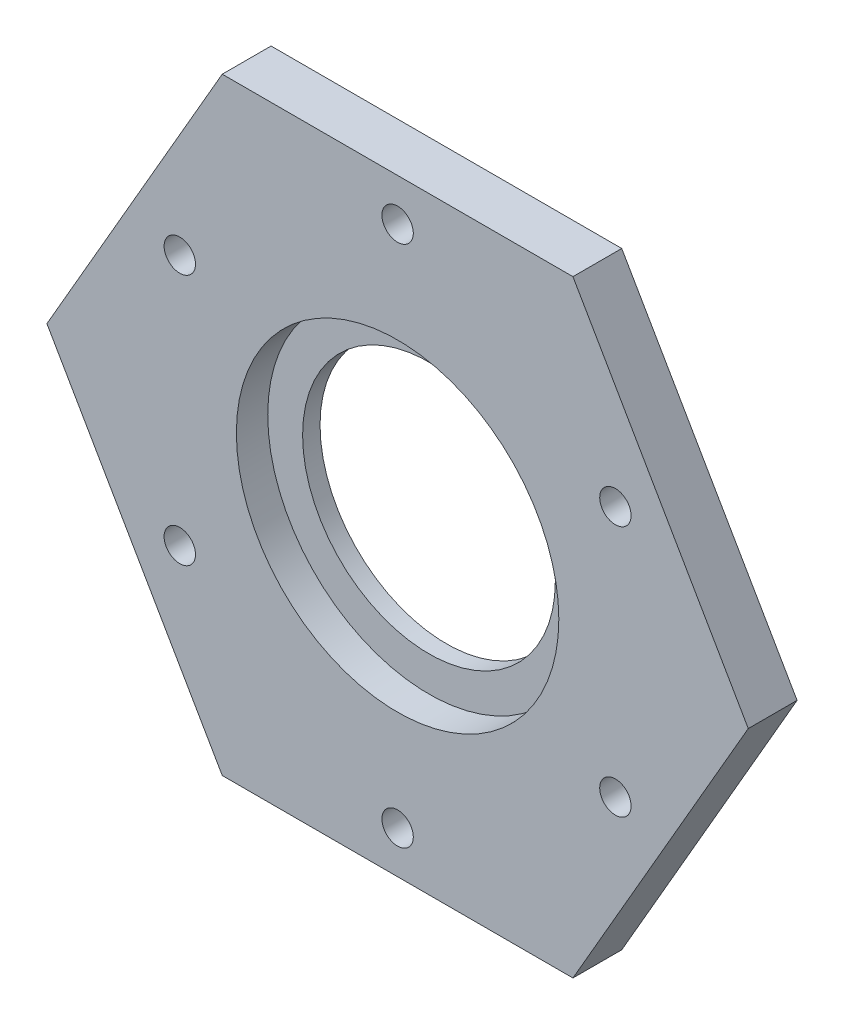
from build123d import *

# Parameters (mm, degrees)
EXTRUDE_1_DEPTH      = 7
CUT_EXTRUDE_1_DEPTH  = 1.8
CUT_EXTRUDE_2_DEPTH  = 3
EXTRUDE_4_DEPTH      = 5.7
EXTRUDE_4_2_DEPTH    = 5.7
EXTRUDE_4_3_DEPTH    = 5.7
EXTRUDE_4_4_DEPTH    = 5.7
EXTRUDE_21_DEPTH     = 3.5
EXTRUDE_21_2_DEPTH   = 3.5
EXTRUDE_21_3_DEPTH   = 3.5
EXTRUDE_21_4_DEPTH   = 3.5
EXTRUDE_22_DEPTH     = 1
CUT_EXTRUDE_3_DEPTH  = 10
CUT_EXTRUDE_4_DEPTH  = 1.5
CUT_EXTRUDE_5_DEPTH  = 1
EXTRUDE_23_DEPTH     = 1.6
SKETCH_17_R          = 0.9
CUT_EXTRUDE_6_DEPTH  = 20
SKETCH_19_R          = 1.75
CUT_EXTRUDE_7_DEPTH  = 2
SKETCH_20_R          = 0.9
CUT_EXTRUDE_8_DEPTH  = 6
EXTRUDE_START        = 2.8
SKETCH_22_R          = 0.9
SKETCH_22_R_2        = 9.25
EXTRUDE_24_DEPTH     = 2.8
SKETCH_24_R          = 9.25
SKETCH_24_R_2        = 7.25
EXTRUDE_25_DEPTH     = 1
SKETCH_25_W          = 43.271682287
SKETCH_25_H          = 17.110923283
CUT_EXTRUDE_9_DEPTH  = 47
SKETCH_26_W          = 20.812214232
SKETCH_26_H          = 53.146859293
CUT_EXTRUDE_10_DEPTH = 99


with BuildPart() as part:
    # 草图1 → 凸台-拉伸1 (new body)
    with BuildSketch(Plane.XY):
        Polygon((10.059401077, 17.423393759), (-10.059401077, 17.423393759), (-20.118802154, 0), (-10.059401077, -17.423393759), (10.059401077, -17.423393759), (20.118802154, 0), align=None)
        Polygon((15.5, 0), (7.75, 13.423393759), (-7.75, 13.423393759), (-15.5, 0), (-7.75, -13.423393759), (7.75, -13.423393759), align=None, mode=Mode.SUBTRACT)
    extrude(amount=EXTRUDE_1_DEPTH)

    # 草图2 → 切除-拉伸1 (cut)
    with BuildSketch(Plane.XY.offset(7)):
        Polygon((6.863269886, -16.440794429), (6.863269886, -13.423393759), (-6.863269886, -13.423393759), (-6.863269886, -16.440794429), (-5.880670556, -17.423393759), (5.880670556, -17.423393759), align=None)
        Polygon((-4.820110193, 16.061828693), (4.820110193, 16.061828693), (5.573466666, 15.349903558), (5.573466666, 13.423393759), (-5.573466666, 13.423393759), (-5.573466666, 15.349903558), align=None)
    extrude(amount=-CUT_EXTRUDE_1_DEPTH, mode=Mode.SUBTRACT)

    # 草图3 → 切除-拉伸2 (cut)
    with BuildSketch(Plane.XY.offset(7)):
        Polygon((8.460606166, 12.192587775), (11.924707781, 14.192587775), (18.428840745, 2.927099023), (14.96473913, 0.927099023), align=None)
    extrude(amount=-CUT_EXTRUDE_2_DEPTH, mode=Mode.SUBTRACT)

    # 草图15 → 切除-拉伸5 (cut)
    with BuildSketch(Plane.XY.offset(5.2)):
        Polygon((-2.444629032, 16.061828693), (-2.444629032, 13.423393759), (-5.573466666, 13.423393759), (-5.573466666, 15.349903558), (-4.820110193, 16.061828693), align=None)
        Polygon((4.820110193, 16.061828693), (2.444629032, 16.061828693), (2.444629032, 13.423393759), (5.573466666, 13.423393759), (5.573466666, 15.349903558), align=None)
    extrude(amount=-CUT_EXTRUDE_5_DEPTH, mode=Mode.SUBTRACT)

    # 草图18 → 凸台-拉伸23 (add)
    with BuildSketch(Plane.XY.offset(7)):
        Polygon((-4.820110193, 16.061828693), (-4.820110193, 17.423393759), (-10.059401077, 17.423393759), (-20.118802154, 0), (-10.059401077, -17.423393759), (-5.880670556, -17.423393759), (-6.863269886, -16.440794429), (-6.863269886, -13.423393759), (-7.75, -13.423393759), (-15.5, 0), (-7.75, 13.423393759), (-5.573466666, 13.423393759), (-5.573466666, 15.349903558), align=None)
        Polygon((4.820110193, 16.061828693), (4.820110193, 17.423393759), (10.059401077, 17.423393759), (11.924707781, 14.192587775), (8.460606166, 12.192587775), (7.75, 13.423393759), (5.573466666, 13.423393759), (5.573466666, 15.349903558), align=None)
        Polygon((18.428840745, 2.927099023), (14.96473913, 0.927099023), (15.5, 0), (7.75, -13.423393759), (6.863269886, -13.423393759), (6.863269886, -16.440794429), (5.880670556, -17.423393759), (10.059401077, -17.423393759), (20.118802154, 0), align=None)
    extrude(amount=EXTRUDE_23_DEPTH)


with BuildPart() as body_2:
    # 草图4 → 凸台-拉伸4 (new body)
    with BuildSketch(Plane(origin=(0, 0, 0), x_dir=(-1, 0, 0), z_dir=(0, 0, -1))):
        Polygon((-11.245593136, -7.368848845), (-6.382277748, -7.368848845), (-6.382277748, -13.423393759), (-7.75, -13.423393759), align=None)
    extrude(amount=-EXTRUDE_4_DEPTH)


with BuildPart() as body_3:
    # 草图4 → Extrude 4 2 (new body)
    with BuildSketch(Plane(origin=(0, 0, 0), x_dir=(-1, 0, 0), z_dir=(0, 0, -1))):
        Polygon((6.145280676, -7.368848845), (11.245593136, -7.368848845), (7.75, -13.423393759), (6.145280676, -13.423393759), align=None)
    extrude(amount=-EXTRUDE_4_2_DEPTH)


with BuildPart() as body_4:
    # 草图4 → Extrude 4 3 (new body)
    with BuildSketch(Plane(origin=(0, 0, 0), x_dir=(-1, 0, 0), z_dir=(0, 0, -1))):
        Polygon((6.145280676, 13.423393759), (6.145280676, 8.488540604), (10.599138797, 8.488540604), (7.75, 13.423393759), align=None)
    extrude(amount=-EXTRUDE_4_3_DEPTH)


with BuildPart() as body_5:
    # 草图4 → Extrude 4 4 (new body)
    with BuildSketch(Plane(origin=(0, 0, 0), x_dir=(-1, 0, 0), z_dir=(0, 0, -1))):
        Polygon((-8.460606166, 12.192587775), (-6.674189613, 11.161199697), (-13.502811472, -0.666320308), (-15.289228025, 0.365067769), align=None)
    extrude(amount=-EXTRUDE_4_4_DEPTH)


with BuildPart() as body_6:
    # 草图6 → 凸台-拉伸21 (new body)
    with BuildSketch(Plane(origin=(0, 0, 0), x_dir=(-1, 0, 0), z_dir=(0, 0, -1))):
        Polygon((-7.167145457, 10.307375129), (-6.189945384, 10.307375129), (-6.189945384, -5.980150499), (-12.0473585, -5.980150499), (-13.626264811, -5.980150499), (-17.36358489, 0), (-11.472554935, 10.307375129), (-9.549034195, 10.307375129), align=None)
    extrude(amount=-EXTRUDE_21_DEPTH)


with BuildPart() as body_7:
    # 草图6 → Extrude 21 2 (new body)
    with BuildSketch(Plane(origin=(0, 0, 0), x_dir=(-1, 0, 0), z_dir=(0, 0, -1))):
        Polygon((-5.839026937, 13.423393759), (-5.839026937, 11.342651293), (5.746496449, 11.342651293), (5.746496449, 13.423393759), (5.746496449, 15.340981073), (-5.839026937, 15.340981073), align=None)
    extrude(amount=-EXTRUDE_21_2_DEPTH)


with BuildPart() as body_8:
    # 草图6 → Extrude 21 3 (new body)
    with BuildSketch(Plane(origin=(0, 0, 0), x_dir=(-1, 0, 0), z_dir=(0, 0, -1))):
        Polygon((6.145280676, 7.264816527), (6.145280676, 3.935780446), (14.892625012, 3.935780446), (12.812129983, 7.264816527), align=None)
    extrude(amount=-EXTRUDE_21_3_DEPTH)


with BuildPart() as body_9:
    # 草图6 → Extrude 21 4 (new body)
    with BuildSketch(Plane(origin=(0, 0, 0), x_dir=(-1, 0, 0), z_dir=(0, 0, -1))):
        Polygon((6.145280676, -5.980150499), (12.0473585, -5.980150499), (13.934439655, -5.980150499), (17.352307472, 0), (6.145280676, 0), align=None)
    extrude(amount=-EXTRUDE_21_4_DEPTH)


with BuildPart() as body_10:
    # 草图12 → 凸台-拉伸22 (new body)
    with BuildSketch(Plane(origin=(0, 0, 0), x_dir=(-1, 0, 0), z_dir=(0, 0, -1))):
        Polygon((-10.059401077, 17.423393759), (-20.118802154, 0), (-10.059401077, -17.423393759), (10.059401077, -17.423393759), (20.118802154, 0), (10.059401077, 17.423393759), align=None)
    extrude(amount=EXTRUDE_22_DEPTH)

    # 草图13 → 切除-拉伸3 (cut)
    with BuildSketch(Plane(origin=(0, 0, -1), x_dir=(-1, 0, 0), z_dir=(0, 0, -1))):
        with BuildLine():
            Line((10.123406841, 1.062471913), (7.135900995, 1.062471913))
            ThreePointArc((7.135900995, 1.062471913), (5.95884516, 2.239527747), (7.135900995, 3.416583581))
            Line((7.135900995, 3.416583581), (10.123406841, 3.416583581))
            ThreePointArc((10.123406841, 3.416583581), (11.300462675, 2.239527747), (10.123406841, 1.062471913))
        make_face()
    extrude(amount=-CUT_EXTRUDE_3_DEPTH, mode=Mode.SUBTRACT)


with BuildPart() as cut_extrude_4_tool:
    # 草图14 → 切除-拉伸4 (new body)
    with BuildSketch(Plane.XY.offset(5.7)):
        Polygon((-7.75, 13.423393759), (-6.145280676, 13.423393759), (-6.145280676, 8.463494867), (-10.599138797, 8.488540604), align=None)
        Polygon((8.460347777, 12.192438594), (8.460347777, 8.067483007), (6.674189613, 11.161199697), align=None)
    extrude(amount=-CUT_EXTRUDE_4_DEPTH)


with BuildPart() as body_4_1:
    add(body_4.part)

    # 切除-拉伸4: cut by cut_extrude_4_tool
    add(cut_extrude_4_tool.part, mode=Mode.SUBTRACT)


with BuildPart() as body_5_1:
    add(body_5.part)

    # 切除-拉伸4: cut by cut_extrude_4_tool
    add(cut_extrude_4_tool.part, mode=Mode.SUBTRACT)


with BuildPart() as cut_extrude_6_tool:
    # 草图17 → 切除-拉伸6 (new body)
    with BuildSketch(Plane(origin=(0, 0, -1), x_dir=(-1, 0, 0), z_dir=(0, 0, -1))):
        with Locations((8, 15)):
            Circle(SKETCH_17_R)
        with Locations((8, -15)):
            Circle(SKETCH_17_R)
        with Locations((-8, -15)):
            Circle(SKETCH_17_R)
        with Locations((-8, 15)):
            Circle(SKETCH_17_R)
        with Locations((17.5, 0)):
            Circle(SKETCH_17_R)
        with Locations((-17.5, 0)):
            Circle(SKETCH_17_R)
    extrude(amount=-CUT_EXTRUDE_6_DEPTH)


with BuildPart() as part_1:
    add(part.part)

    # 切除-拉伸6: cut by cut_extrude_6_tool
    add(cut_extrude_6_tool.part, mode=Mode.SUBTRACT)


with BuildPart() as body_6_1:
    add(body_6.part)

    # 切除-拉伸6: cut by cut_extrude_6_tool
    add(cut_extrude_6_tool.part, mode=Mode.SUBTRACT)


with BuildPart() as body_9_1:
    add(body_9.part)

    # 切除-拉伸6: cut by cut_extrude_6_tool
    add(cut_extrude_6_tool.part, mode=Mode.SUBTRACT)


with BuildPart() as body_10_1:
    add(body_10.part)

    # 切除-拉伸6: cut by cut_extrude_6_tool
    add(cut_extrude_6_tool.part, mode=Mode.SUBTRACT)


with BuildPart() as cut_extrude_7_tool:
    # 草图19 → 切除-拉伸7 (new body)
    with BuildSketch(Plane(origin=(0, 0, -1), x_dir=(-1, 0, 0), z_dir=(0, 0, -1))):
        with Locations((-8, 15)):
            Circle(SKETCH_19_R)
        with Locations((-17.5, 0)):
            Circle(SKETCH_19_R)
        with Locations((-8, -15)):
            Circle(SKETCH_19_R)
        with Locations((8, -15)):
            Circle(SKETCH_19_R)
        with Locations((17.5, 0)):
            Circle(SKETCH_19_R)
        with Locations((8, 15)):
            Circle(SKETCH_19_R)
    extrude(amount=-CUT_EXTRUDE_7_DEPTH)


with BuildPart() as part_2:
    add(part_1.part)

    # 切除-拉伸7: cut by cut_extrude_7_tool
    add(cut_extrude_7_tool.part, mode=Mode.SUBTRACT)


with BuildPart() as body_2_1:
    add(body_2.part)

    # 切除-拉伸7: cut by cut_extrude_7_tool
    add(cut_extrude_7_tool.part, mode=Mode.SUBTRACT)


with BuildPart() as body_3_1:
    add(body_3.part)

    # 切除-拉伸7: cut by cut_extrude_7_tool
    add(cut_extrude_7_tool.part, mode=Mode.SUBTRACT)


with BuildPart() as body_4_2:
    add(body_4_1.part)

    # 切除-拉伸7: cut by cut_extrude_7_tool
    add(cut_extrude_7_tool.part, mode=Mode.SUBTRACT)


with BuildPart() as body_6_2:
    add(body_6_1.part)

    # 切除-拉伸7: cut by cut_extrude_7_tool
    add(cut_extrude_7_tool.part, mode=Mode.SUBTRACT)


with BuildPart() as body_9_2:
    add(body_9_1.part)

    # 切除-拉伸7: cut by cut_extrude_7_tool
    add(cut_extrude_7_tool.part, mode=Mode.SUBTRACT)


with BuildPart() as body_10_2:
    add(body_10_1.part)

    # 切除-拉伸7: cut by cut_extrude_7_tool
    add(cut_extrude_7_tool.part, mode=Mode.SUBTRACT)


with BuildPart() as cut_extrude_8_tool:
    # 草图20 → 切除-拉伸8 (new body)
    with BuildSketch(Plane(origin=(0, 0, -1), x_dir=(-1, 0, 0), z_dir=(0, 0, -1))):
        with Locations((0, 15)):
            Circle(SKETCH_20_R)
        with Locations((-12.495190528, 7.214101615)):
            Circle(SKETCH_20_R)
        with Locations((12.495190528, 7.214101615)):
            Circle(SKETCH_20_R)
        with Locations((-12.495190528, -7.214101615)):
            Circle(SKETCH_20_R)
        with Locations((12.495190528, -7.214101615)):
            Circle(SKETCH_20_R)
        with Locations((0, -15)):
            Circle(SKETCH_20_R)
    extrude(amount=-CUT_EXTRUDE_8_DEPTH)


with BuildPart() as part_3:
    add(part_2.part)

    # 切除-拉伸8: cut by cut_extrude_8_tool
    add(cut_extrude_8_tool.part, mode=Mode.SUBTRACT)


with BuildPart() as body_6_3:
    add(body_6_2.part)

    # 切除-拉伸8: cut by cut_extrude_8_tool
    add(cut_extrude_8_tool.part, mode=Mode.SUBTRACT)


with BuildPart() as body_7_1:
    add(body_7.part)

    # 切除-拉伸8: cut by cut_extrude_8_tool
    add(cut_extrude_8_tool.part, mode=Mode.SUBTRACT)


with BuildPart() as body_8_1:
    add(body_8.part)

    # 切除-拉伸8: cut by cut_extrude_8_tool
    add(cut_extrude_8_tool.part, mode=Mode.SUBTRACT)


with BuildPart() as body_10_3:
    add(body_10_2.part)

    # 切除-拉伸8: cut by cut_extrude_8_tool
    add(cut_extrude_8_tool.part, mode=Mode.SUBTRACT)

    # 草图22 → 凸台-拉伸24 (add)
    with BuildSketch(Plane(origin=(0, 0, -1), x_dir=(-1, 0, 0), z_dir=(0, 0, -1)).offset(EXTRUDE_START)):
        Polygon((10.059401077, 17.423393759), (-10.059401077, 17.423393759), (-20.118802154, 0), (-10.059401077, -17.423393759), (10.059401077, -17.423393759), (20.118802154, 0), align=None)
        with Locations((-12.495190528, 7.214101615)):
            Circle(SKETCH_22_R, mode=Mode.SUBTRACT)
        with Locations((-12.495190528, -7.214101615)):
            Circle(SKETCH_22_R, mode=Mode.SUBTRACT)
        with Locations((0, -15)):
            Circle(SKETCH_22_R, mode=Mode.SUBTRACT)
        with Locations((12.495190528, -7.214101615)):
            Circle(SKETCH_22_R, mode=Mode.SUBTRACT)
        with Locations((12.495190528, 7.214101615)):
            Circle(SKETCH_22_R, mode=Mode.SUBTRACT)
        with Locations((0, 15)):
            Circle(SKETCH_22_R, mode=Mode.SUBTRACT)
        with Locations(Location((0, 0, 0), (0, 0, 21.676176117))):
            Circle(SKETCH_22_R_2, mode=Mode.SUBTRACT)
    extrude(amount=-EXTRUDE_24_DEPTH)

    # 草图24 → 凸台-拉伸25 (add)
    with BuildSketch(Plane(origin=(0, 0, -3.8), x_dir=(-1, 0, 0), z_dir=(0, 0, -1))):
        with Locations(Location((0, 0, 0), (0, 0, 21.676176117))):
            Circle(SKETCH_24_R)
        Circle(SKETCH_24_R_2, mode=Mode.SUBTRACT)
    extrude(amount=-EXTRUDE_25_DEPTH)

    # 草图26 → 切除-拉伸10 (cut)
    with BuildSketch(Plane(origin=(-15.089101615, -8.711696879, 0), x_dir=(0, 0, 1), z_dir=(-0.8660254037844423, -0.4999999999999939, 0))):
        with Locations((9.406107116, 5.866376364)):
            Rectangle(SKETCH_26_W, SKETCH_26_H)
    extrude(amount=-CUT_EXTRUDE_10_DEPTH, mode=Mode.SUBTRACT)


with BuildPart() as cut_extrude_9_tool:
    # 草图25 → 切除-拉伸9 (new body)
    with BuildSketch(Plane.XZ.offset(17.423393759)):
        with Locations((-1.517038989, 7.555461642)):
            Rectangle(SKETCH_25_W, SKETCH_25_H)
    extrude(amount=-CUT_EXTRUDE_9_DEPTH)


with BuildPart() as body_5_2:
    add(body_5_1.part)

    # 切除-拉伸9: cut by cut_extrude_9_tool
    add(cut_extrude_9_tool.part, mode=Mode.SUBTRACT)


with BuildPart() as body_2_2:
    add(body_2_1.part)

    # 切除-拉伸9: cut by cut_extrude_9_tool
    add(cut_extrude_9_tool.part, mode=Mode.SUBTRACT)


with BuildPart() as body_3_2:
    add(body_3_1.part)

    # 切除-拉伸9: cut by cut_extrude_9_tool
    add(cut_extrude_9_tool.part, mode=Mode.SUBTRACT)


with BuildPart() as body_4_3:
    add(body_4_2.part)

    # 切除-拉伸9: cut by cut_extrude_9_tool
    add(cut_extrude_9_tool.part, mode=Mode.SUBTRACT)


with BuildPart() as body_9_3:
    add(body_9_2.part)

    # 切除-拉伸9: cut by cut_extrude_9_tool
    add(cut_extrude_9_tool.part, mode=Mode.SUBTRACT)


with BuildPart() as body_7_2:
    add(body_7_1.part)

    # 切除-拉伸9: cut by cut_extrude_9_tool
    add(cut_extrude_9_tool.part, mode=Mode.SUBTRACT)


with BuildPart() as body_8_2:
    add(body_8_1.part)

    # 切除-拉伸9: cut by cut_extrude_9_tool
    add(cut_extrude_9_tool.part, mode=Mode.SUBTRACT)


with BuildPart() as body_6_4:
    add(body_6_3.part)

    # 切除-拉伸9: cut by cut_extrude_9_tool
    add(cut_extrude_9_tool.part, mode=Mode.SUBTRACT)


with BuildPart() as part_4:
    add(part_3.part)

    # 切除-拉伸9: cut by cut_extrude_9_tool
    add(cut_extrude_9_tool.part, mode=Mode.SUBTRACT)


solid = body_10_3.part
